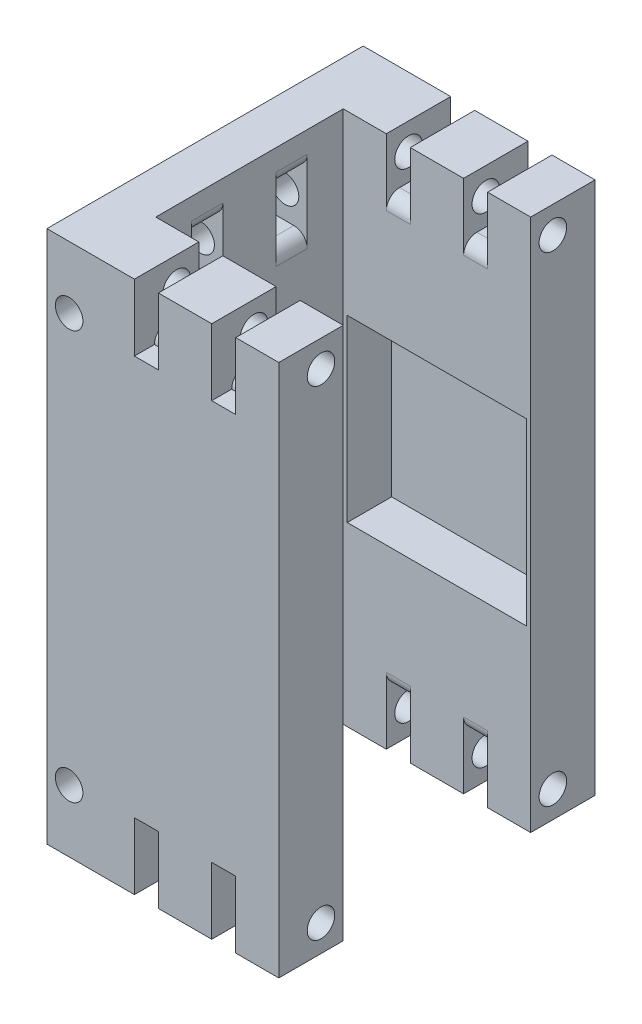
from build123d import *

# Parameters (mm, degrees)
SKETCH_1_W               = 31.1
SKETCH_1_H               = 31.1
SKETCH_1_W_2             = 21.1
SKETCH_1_H_2             = 21.1
EXTRUDE_1_DEPTH          = 60
SKETCH_2_R               = 1.55
CUT_EXTRUDE_1_DEPTH      = 73.445979875
CUT_EXTRUDE_2_DEPTH      = 71.444446197
CUT_EXTRUDE_2_DEPTH_BACK = 71.444446197
SKETCH_3_W               = 2.7
SKETCH_3_H               = 6
SKETCH_4_R               = 1.55
CUT_EXTRUDE_3_DEPTH      = 73.445979875
CUT_EXTRUDE_4_DEPTH      = 71.444446197
CUT_EXTRUDE_4_DEPTH_BACK = 71.444446197
SKETCH_5_W               = 3.5
SKETCH_5_H               = 6.2
FILLET_1_R               = 1.5
SKETCH_6_W               = 20.2
SKETCH_6_H               = 20.2
CUT_EXTRUDE_5_DEPTH      = 73.445979875
SKETCH_7_R               = 1.55
EXTRUDE_2_DEPTH          = 2.25
EXTRUDE_START            = 2.25
SKETCH_8_R               = 1.55
EXTRUDE_3_DEPTH          = 2.25
SKETCH_9_W               = 5
SKETCH_9_H               = 60
CUT_EXTRUDE_6_DEPTH      = 75.488723979


with BuildPart() as part:
    # 草图1 → 凸台-拉伸1 (new body)
    with BuildSketch(Plane(origin=(0, 0, 0), x_dir=(1, 0, 0), z_dir=(0, 1, 0))):
        with Locations((10.55, 10.55)):
            Rectangle(SKETCH_1_W, SKETCH_1_H)
        with Locations((10.55, 10.55)):
            Rectangle(SKETCH_1_W_2, SKETCH_1_H_2, mode=Mode.SUBTRACT)
    extrude(amount=EXTRUDE_1_DEPTH)

    # 草图2 → 切除-拉伸1 (cut, through all)
    with BuildSketch(Plane.ZY.offset(5)):
        with Locations((-23.6, 57)):
            Circle(SKETCH_2_R)
        with Locations((-23.6, 3)):
            Circle(SKETCH_2_R)
        with Locations((2.5, 3)):
            Circle(SKETCH_2_R)
        with Locations((2.5, 57)):
            Circle(SKETCH_2_R)
    extrude(amount=-CUT_EXTRUDE_1_DEPTH, mode=Mode.SUBTRACT)

    # 草图3 → 切除-拉伸2 (cut, two sides: drawn at the far end of the back side and taken through both)
    with BuildSketch(Plane.XY.offset(-21.1).offset(-CUT_EXTRUDE_2_DEPTH_BACK)):
        with Locations((6.2, 57)):
            Rectangle(SKETCH_3_W, SKETCH_3_H)
        with Locations((14.9, 57)):
            Rectangle(SKETCH_3_W, SKETCH_3_H)
        with Locations((14.9, 3)):
            Rectangle(SKETCH_3_W, SKETCH_3_H)
        with Locations((6.2, 3)):
            Rectangle(SKETCH_3_W, SKETCH_3_H)
    extrude(amount=CUT_EXTRUDE_2_DEPTH + CUT_EXTRUDE_2_DEPTH_BACK, mode=Mode.SUBTRACT)

    # 草图4 → 切除-拉伸3 (cut, through all)
    with BuildSketch(Plane(origin=(0, 0, -26.1), x_dir=(-1, 0, 0), z_dir=(0, 0, -1))):
        with Locations((-23.6, 53)):
            Circle(SKETCH_4_R)
        with Locations((2.5, 53)):
            Circle(SKETCH_4_R)
        with Locations((2.5, 7)):
            Circle(SKETCH_4_R)
        with Locations((-23.6, 7)):
            Circle(SKETCH_4_R)
    extrude(amount=-CUT_EXTRUDE_3_DEPTH, mode=Mode.SUBTRACT)

    # 草图5 → 切除-拉伸4 (cut, two sides: drawn at the far end of the back side and taken through both)
    with BuildSketch(Plane.ZY.offset(-21.1).offset(-CUT_EXTRUDE_4_DEPTH_BACK)):
        with Locations((-15.3, 53)):
            Rectangle(SKETCH_5_W, SKETCH_5_H)
        with Locations((-5.8, 53)):
            Rectangle(SKETCH_5_W, SKETCH_5_H)
        with Locations((-5.8, 7)):
            Rectangle(SKETCH_5_W, SKETCH_5_H)
        with Locations((-15.3, 7)):
            Rectangle(SKETCH_5_W, SKETCH_5_H)
    extrude(amount=CUT_EXTRUDE_4_DEPTH + CUT_EXTRUDE_4_DEPTH_BACK, mode=Mode.SUBTRACT)

    # 圆角1
    fillet_1_edges = [part.edges().sort_by_distance(p)[0] for p in [
        (14.9, 6, 0),
        (14.9, 6, -26.1),
        (14.9, 6, 5),
        (14.9, 54, 0),
        (14.9, 54, -26.1),
        (14.9, 54, 5),
        (6.2, 54, 0),
        (6.2, 54, -26.1),
        (6.2, 54, 5),
        (21.1, 49.9, -15.3),
        (21.1, 56.1, -15.3),
        (21.1, 49.9, -5.8),
        (21.1, 56.1, -5.8),
        (21.1, 10.1, -5.8),
        (21.1, 3.9, -5.8),
        (21.1, 10.1, -15.3),
        (21.1, 3.9, -15.3),
        (0, 3.9, -15.3),
        (0, 10.1, -15.3),
        (26.1, 3.9, -15.3),
        (26.1, 10.1, -15.3),
        (-5, 3.9, -15.3),
        (-5, 10.1, -15.3),
        (0, 3.9, -5.8),
        (0, 10.1, -5.8),
        (26.1, 3.9, -5.8),
        (26.1, 10.1, -5.8),
        (-5, 3.9, -5.8),
        (-5, 10.1, -5.8),
        (0, 56.1, -5.8),
        (0, 49.9, -5.8),
        (26.1, 56.1, -5.8),
        (26.1, 49.9, -5.8),
        (-5, 49.9, -5.8),
        (-5, 56.1, -5.8),
        (0, 56.1, -15.3),
        (0, 49.9, -15.3),
        (26.1, 56.1, -15.3),
        (26.1, 49.9, -15.3),
        (-5, 49.9, -15.3),
        (-5, 56.1, -15.3),
        (6.2, 54, -21.1),
        (14.9, 54, -21.1),
        (14.9, 6, -21.1),
        (6.2, 6, -21.1),
        (6.2, 6, 0),
        (6.2, 6, -26.1),
        (6.2, 6, 5),
    ]]
    fillet(fillet_1_edges, radius=FILLET_1_R)

    # 草图6 → 切除-拉伸5 (cut, through all)
    with BuildSketch(Plane.XY.offset(5)):
        with Locations((10.55, 30)):
            Rectangle(SKETCH_6_W, SKETCH_6_H)
    extrude(amount=-CUT_EXTRUDE_5_DEPTH, mode=Mode.SUBTRACT)

    # 草图7 → 凸台-拉伸2 (add)
    with BuildSketch(Plane.XY.offset(5)):
        Polygon((13.55, 0), (13.55, 7.5), (16.25, 7.5), (16.25, 0), (26.1, 0), (26.1, 60), (16.25, 60), (16.25, 52.5), (13.55, 52.5), (13.55, 60), (7.55, 60), (7.55, 52.5), (4.85, 52.5), (4.85, 60), (-5, 60), (-5, 0), (4.85, 0), (4.85, 7.5), (7.55, 7.5), (7.55, 0), align=None)
        with Locations(Location((23.6, 7, 0), (0, 0, 180))):
            Circle(SKETCH_7_R, mode=Mode.SUBTRACT)
        with Locations(Location((23.6, 53, 0), (0, 0, 180))):
            Circle(SKETCH_7_R, mode=Mode.SUBTRACT)
        with Locations(Location((-2.5, 53, 0), (0, 0, 180))):
            Circle(SKETCH_7_R, mode=Mode.SUBTRACT)
        with Locations(Location((-2.5, 7, 0), (0, 0, 180))):
            Circle(SKETCH_7_R, mode=Mode.SUBTRACT)
    extrude(amount=EXTRUDE_2_DEPTH)

    # 草图8 → 凸台-拉伸3 (add)
    with BuildSketch(Plane(origin=(0, 0, -26.1), x_dir=(-1, 0, 0), z_dir=(0, 0, -1)).offset(EXTRUDE_START)):
        Polygon((-7.55, 7.5), (-4.85, 7.5), (-4.85, 0), (5, 0), (5, 60), (-4.85, 60), (-4.85, 52.5), (-7.55, 52.5), (-7.55, 60), (-13.55, 60), (-13.55, 52.5), (-16.25, 52.5), (-16.25, 60), (-26.1, 60), (-26.1, 0), (-16.25, 0), (-16.25, 7.5), (-13.55, 7.5), (-13.55, 0), (-7.55, 0), align=None)
        with Locations((-23.6, 7)):
            Circle(SKETCH_8_R, mode=Mode.SUBTRACT)
        with Locations((2.5, 7)):
            Circle(SKETCH_8_R, mode=Mode.SUBTRACT)
        with Locations((2.5, 53)):
            Circle(SKETCH_8_R, mode=Mode.SUBTRACT)
        with Locations((-23.6, 53)):
            Circle(SKETCH_8_R, mode=Mode.SUBTRACT)
    extrude(amount=-EXTRUDE_3_DEPTH)

    # 草图9 → 切除-拉伸6 (cut, through all)
    with BuildSketch(Plane(origin=(0, 0, -28.35), x_dir=(-1, 0, 0), z_dir=(0, 0, -1))):
        with Locations((-23.6, 30)):
            Rectangle(SKETCH_9_W, SKETCH_9_H)
    extrude(amount=-CUT_EXTRUDE_6_DEPTH, mode=Mode.SUBTRACT)


solid = part.part
